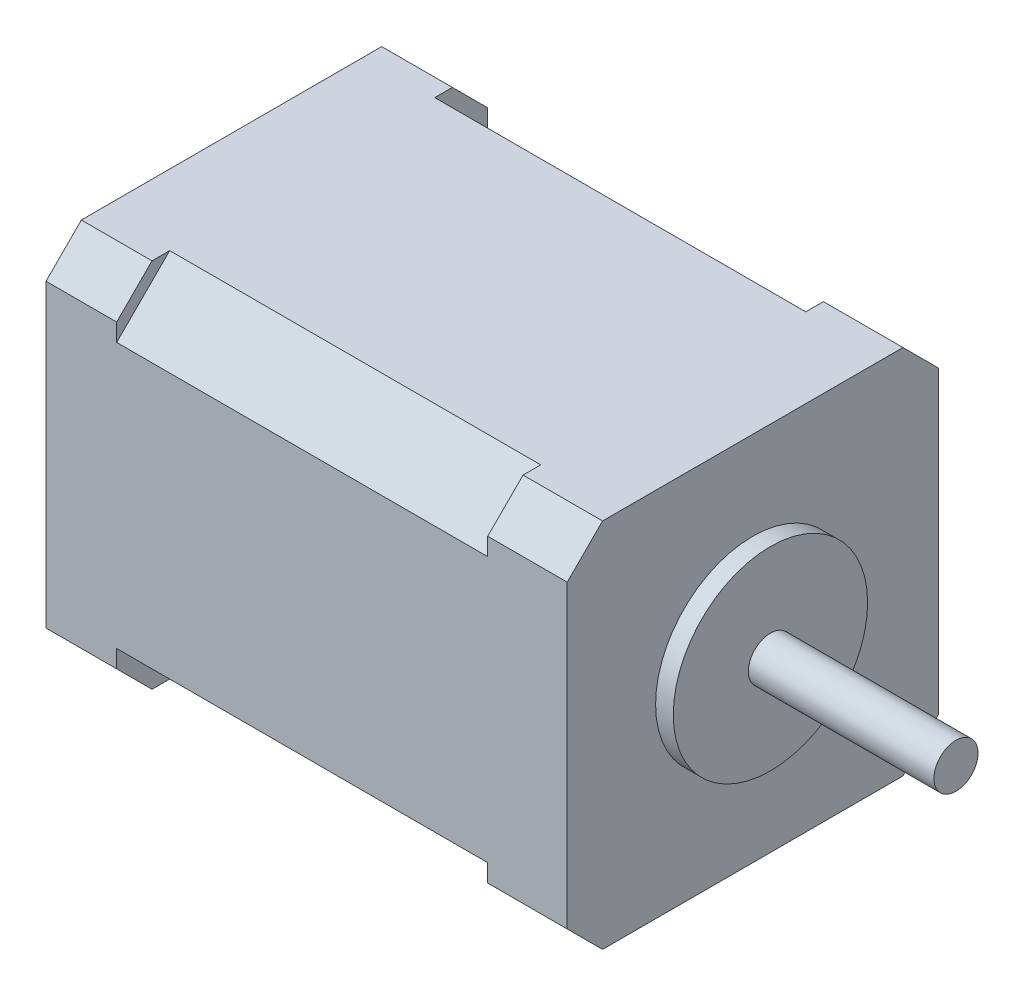
from build123d import *

# Parameters (mm, degrees)
SKETCH_1_W          = 42
SKETCH_1_H          = 42
EXTRUDE_1_DEPTH     = 59
SKETCH_2_R          = 11
EXTRUDE_2_DEPTH     = 2
SKETCH_3_R          = 2.5
EXTRUDE_3_DEPTH     = 21
CUT_EXTRUDE_START   = -8
CUT_EXTRUDE_1_DEPTH = 42
CHAMFER_1_SIZE      = 4


with BuildPart() as part:
    # 草图1 → 凸台-拉伸1 (new body)
    with BuildSketch(Plane(origin=(0, 0, 0), x_dir=(0, 0, -1), z_dir=(1, 0, 0))):
        Rectangle(SKETCH_1_W, SKETCH_1_H)
    extrude(amount=EXTRUDE_1_DEPTH)

    # 草图2 → 凸台-拉伸2 (add)
    with BuildSketch(Plane(origin=(59, 0, 0), x_dir=(0, 0, -1), z_dir=(1, 0, 0))):
        Circle(SKETCH_2_R)
    extrude(amount=EXTRUDE_2_DEPTH)

    # 草图3 → 凸台-拉伸3 (add)
    with BuildSketch(Plane(origin=(61, 0, 0), x_dir=(0, 0, -1), z_dir=(1, 0, 0))):
        with Locations(Location((0, 0, 0), (0, 0, 180))):
            Circle(SKETCH_3_R)
    extrude(amount=EXTRUDE_3_DEPTH)

    # 草图5 → 切除-拉伸1 (cut)
    with BuildSketch(Plane.ZY.offset(CUT_EXTRUDE_START)):
        Polygon((21, 15), (15, 21), (21, 21), align=None)
        Polygon((21, -21), (21, -15), (15, -21), align=None)
        Polygon((-21, 21), (-21, 15), (-15, 21), align=None)
        Polygon((-21, -15), (-15, -21), (-21, -21), align=None)
    extrude(amount=-CUT_EXTRUDE_1_DEPTH, mode=Mode.SUBTRACT)

    # 倒角1
    chamfer_1_edges = [part.edges().sort_by_distance(p)[0] for p in [
        (4, 21, 21),
        (4, 21, -21),
        (4, -21, -21),
        (4, -21, 21),
        (54.5, 21, 21),
        (54.5, 21, -21),
        (54.5, -21, -21),
        (54.5, -21, 21),
    ]]
    chamfer(chamfer_1_edges, length=CHAMFER_1_SIZE)


solid = part.part
